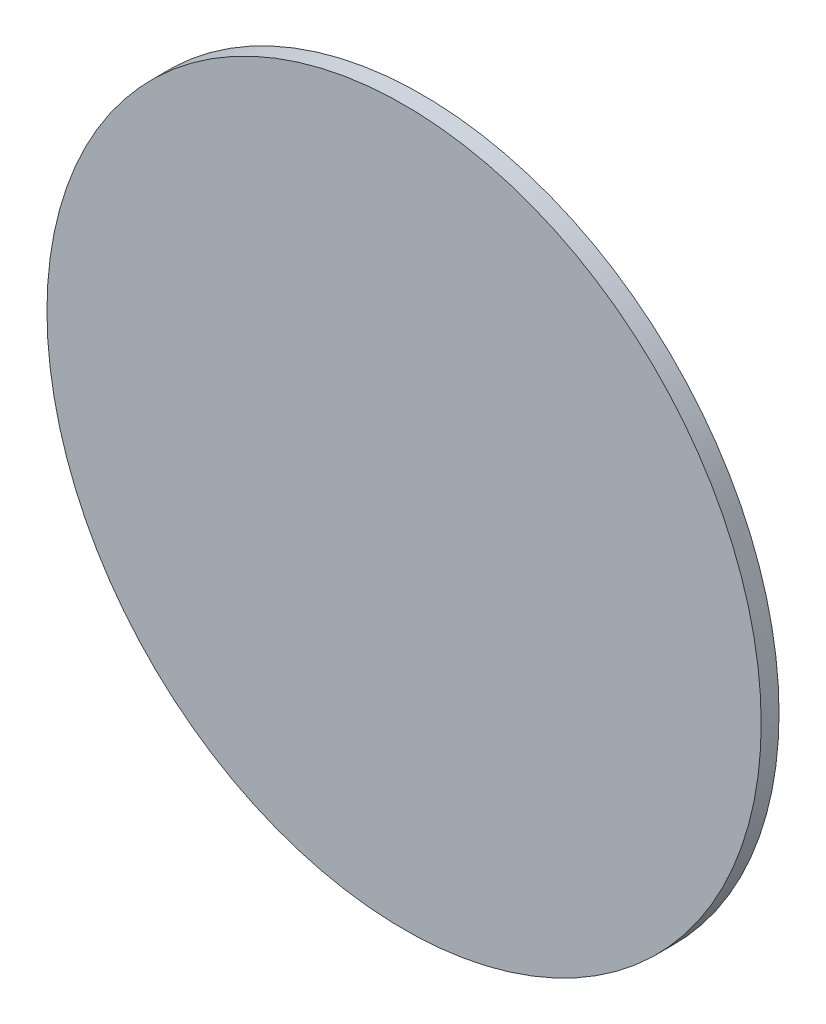
from build123d import *

# Parameters (mm, degrees)
SKETCH1_R           = 20
BOSS_EXTRUDE1_DEPTH = 1


with BuildPart() as part:
    # Sketch1 → Boss-Extrude1 (new body)
    with BuildSketch(Plane.XY):
        Circle(SKETCH1_R)
    extrude(amount=BOSS_EXTRUDE1_DEPTH)


solid = part.part
